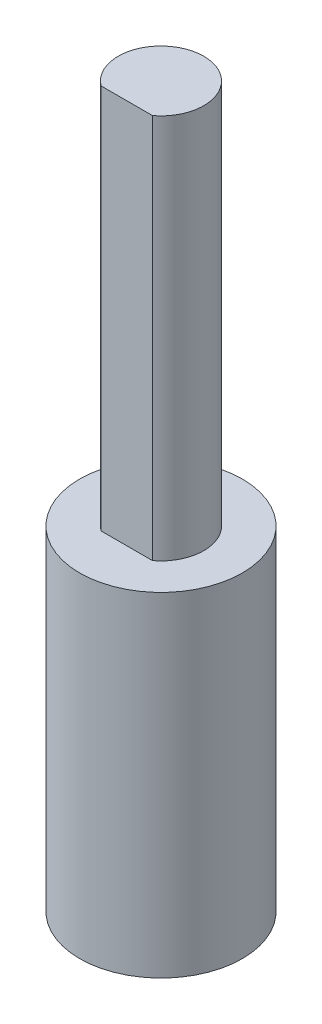
from build123d import *

# Parameters (mm, degrees)
SKETCH_1_R      = 4.75
EXTRUDE_1_DEPTH = 19.5
EXTRUDE_2_DEPTH = 22.5


with BuildPart() as part:
    # 草图1 → 凸台-拉伸1 (new body)
    with BuildSketch(Plane(origin=(0, 0, 0), x_dir=(1, 0, 0), z_dir=(0, 1, 0))):
        with Locations(Location((0, 0, 0), (0, 0, 270))):
            Circle(SKETCH_1_R)
    extrude(amount=EXTRUDE_1_DEPTH)

    # 草图2 → 凸台-拉伸2 (add)
    with BuildSketch(Plane(origin=(0, 19.5, 0), x_dir=(1, 0, 0), z_dir=(0, 1, 0))):
        with BuildLine():
            ThreePointArc((2.5, 0), (-1.118033989, 2.236067977), (-1.5, -2))
            Line((-1.5, -2), (1.5, -2))
            ThreePointArc((1.5, -2), (2.236067977, -1.118033989), (2.5, 0))
        make_face()
    extrude(amount=EXTRUDE_2_DEPTH)


solid = part.part
